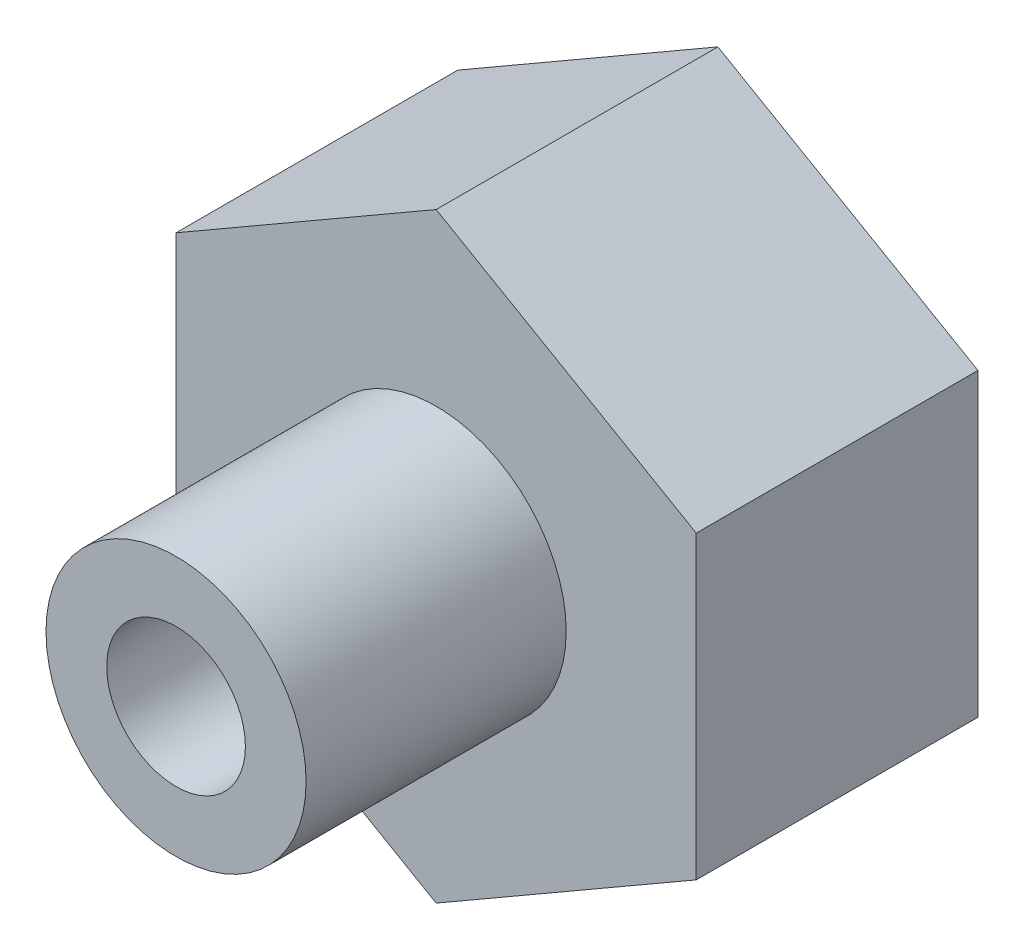
from build123d import *

# Parameters (mm, degrees)
HEX_NUT_DEPTH         = 13
SKETCH2_R             = 10.4775
THREAD_BORE_DEPTH     = 11
PUSH_FIT_PORT_START   = 13
SKETCH3_R             = 6
PUSH_FIT_PORT_DEPTH   = 12
PUSH_FIT_SOCKET_START = 25
SKETCH4_R             = 3.2
PUSH_FIT_SOCKET_DEPTH = 10


with BuildPart() as part:
    # Sketch1 → Hex_Nut (new body)
    with BuildSketch(Plane.XY):
        Polygon((12, 6.92820323), (0, 13.856406461), (-12, 6.92820323), (-12, -6.92820323), (0, -13.856406461), (12, -6.92820323), align=None)
    extrude(amount=HEX_NUT_DEPTH)

    # Sketch2 → Thread_Bore (cut)
    with BuildSketch(Plane.XY):
        Circle(SKETCH2_R)
    extrude(amount=THREAD_BORE_DEPTH, mode=Mode.SUBTRACT)

    # Sketch3 → Push_Fit_Port (add)
    with BuildSketch(Plane.XY.offset(PUSH_FIT_PORT_START)):
        Circle(SKETCH3_R)
    extrude(amount=PUSH_FIT_PORT_DEPTH)

    # Sketch4 → Push_Fit_Socket (cut)
    with BuildSketch(Plane.XY.offset(PUSH_FIT_SOCKET_START)):
        Circle(SKETCH4_R)
    extrude(amount=-PUSH_FIT_SOCKET_DEPTH, mode=Mode.SUBTRACT)


solid = part.part
